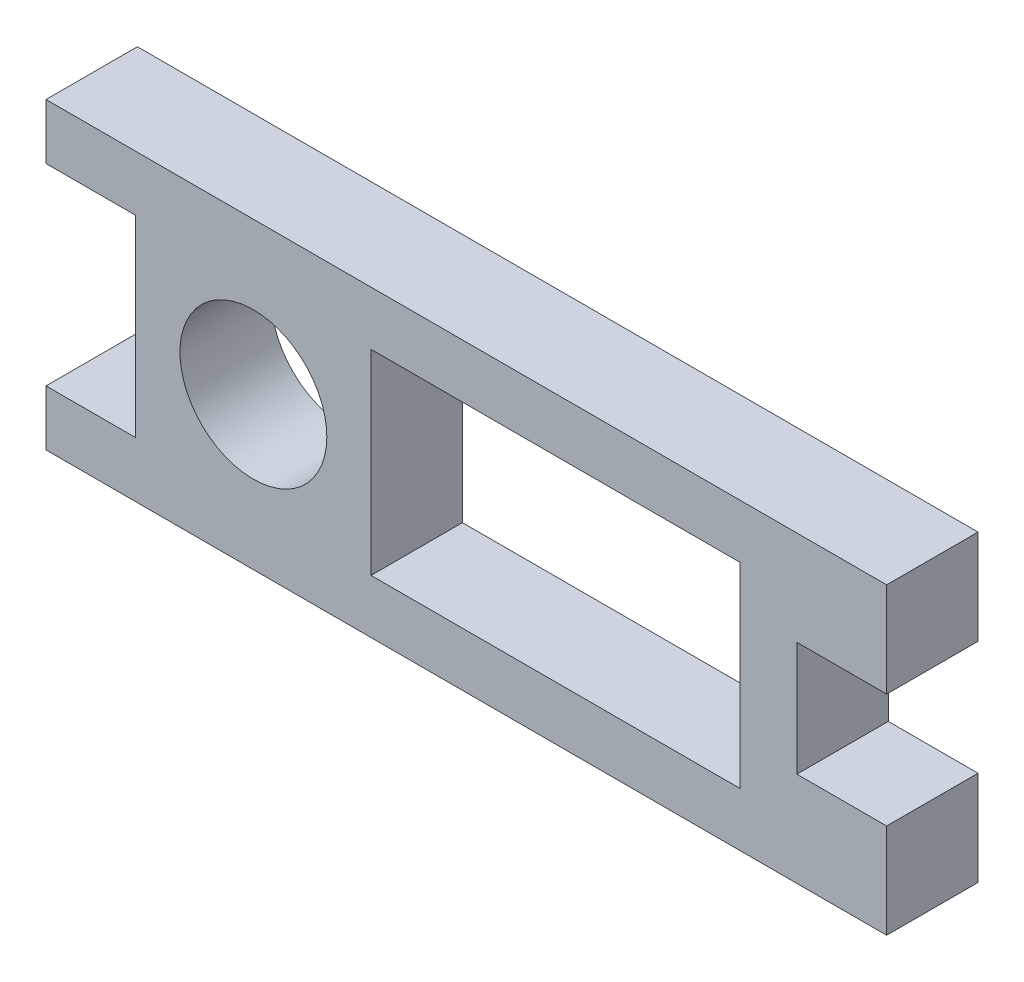
from build123d import *

# Parameters (mm, degrees)
SKETCH1_R           = 4.5
SKETCH1_W           = 22.6
SKETCH1_H           = 12
BOSS_EXTRUDE1_DEPTH = 5.6


with BuildPart() as part:
    # Sketch1 → Boss-Extrude1 (new body)
    with BuildSketch(Plane.XY):
        Polygon((704.254416841, 403.699543709), (704.254416841, 391.899543709), (698.754416841, 391.899543709), (698.754416841, 388.499543709), (750.274416841, 388.499543709), (750.274416841, 394.299543709), (744.774416841, 394.299543709), (744.774416841, 401.299543709), (750.274416841, 401.299543709), (750.274416841, 407.099543709), (698.754416841, 407.099543709), (698.754416841, 403.699543709), align=None)
        with Locations((711.464416841, 397.799543709)):
            Circle(SKETCH1_R, mode=Mode.SUBTRACT)
        with Locations((729.974416841, 397.799543709)):
            Rectangle(SKETCH1_W, SKETCH1_H, mode=Mode.SUBTRACT)
    extrude(amount=BOSS_EXTRUDE1_DEPTH)


solid = part.part
